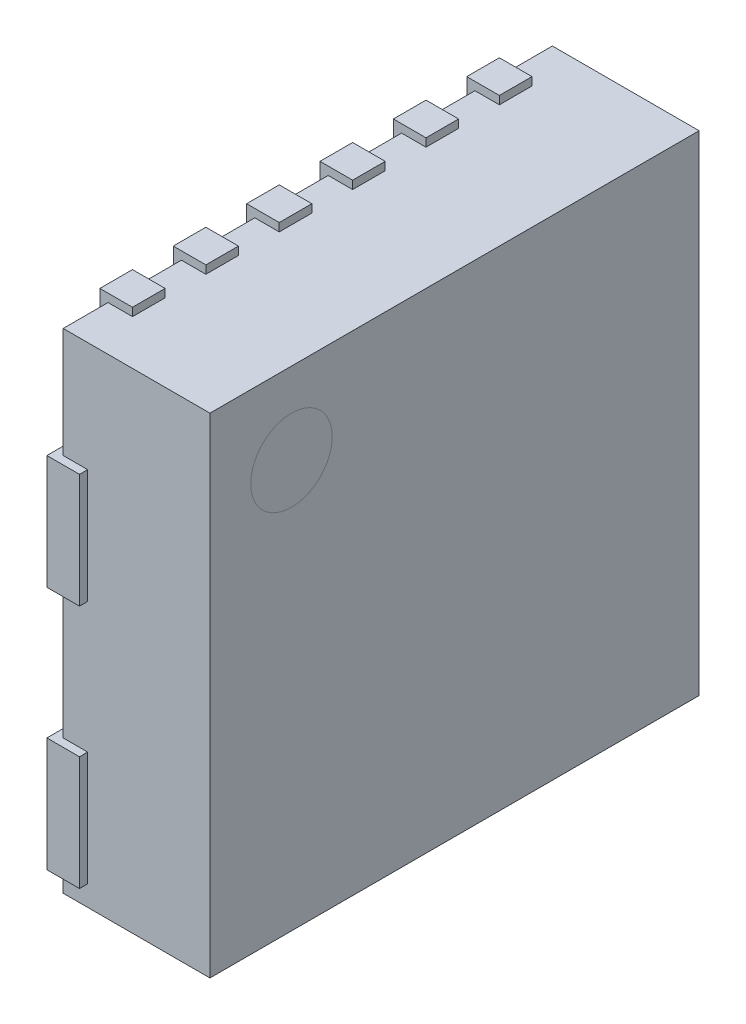
from build123d import *

# Parameters (mm, degrees)
SKETCH_1_W              = 3
SKETCH_1_H              = 3
EXTRUDE_1_DEPTH         = 0.9
SKETCH_2_R              = 0.25
CUT_EXTRUDE_1_DEPTH     = 0.1
SKETCH_3_R              = 0.25
EXTRUDE_2_DEPTH         = 0.05
EXTRUDE_3_DEPTH         = 0.05
EXTRUDE_3_DEPTH_BACK    = 0.15
SKETCH_4_W              = 0.2
SKETCH_4_H              = 0.4
EXTRUDE_3_2_DEPTH       = 0.05
EXTRUDE_3_2_DEPTH_BACK  = 0.15
EXTRUDE_3_3_DEPTH       = 0.05
EXTRUDE_3_3_DEPTH_BACK  = 0.15
EXTRUDE_3_4_DEPTH       = 0.05
EXTRUDE_3_4_DEPTH_BACK  = 0.15
EXTRUDE_3_5_DEPTH       = 0.05
EXTRUDE_3_5_DEPTH_BACK  = 0.15
EXTRUDE_3_6_DEPTH       = 0.05
EXTRUDE_3_6_DEPTH_BACK  = 0.15
EXTRUDE_3_7_DEPTH       = 0.05
EXTRUDE_3_7_DEPTH_BACK  = 0.15
EXTRUDE_3_8_DEPTH       = 0.05
EXTRUDE_3_8_DEPTH_BACK  = 0.15
EXTRUDE_3_9_DEPTH       = 0.05
EXTRUDE_3_9_DEPTH_BACK  = 0.15
EXTRUDE_3_10_DEPTH      = 0.05
EXTRUDE_3_10_DEPTH_BACK = 0.15
SKETCH_4_W_2            = 1
SKETCH_4_H_2            = 0.26
EXTRUDE_3_11_DEPTH      = 0.05
EXTRUDE_3_11_DEPTH_BACK = 0.15
EXTRUDE_3_12_DEPTH      = 0.05
EXTRUDE_3_12_DEPTH_BACK = 0.15
SKETCH_4_H_3            = 0.7


with BuildPart() as part:
    # Эскиз1 → Бобышка-Вытянуть1 (new body)
    with BuildSketch(Plane(origin=(0.05, 0, 0), x_dir=(0, 0, -1), z_dir=(1, 0, 0))):
        Rectangle(SKETCH_1_W, SKETCH_1_H)
    extrude(amount=EXTRUDE_1_DEPTH)

    # Эскиз2 → Вырез-Вытянуть1 (cut)
    with BuildSketch(Plane(origin=(0.95, 0, 0), x_dir=(0, 0, -1), z_dir=(1, 0, 0))):
        with Locations((-1, 1)):
            Circle(SKETCH_2_R)
    extrude(amount=-CUT_EXTRUDE_1_DEPTH, mode=Mode.SUBTRACT)


with BuildPart() as body_2:
    # Эскиз3 → Бобышка-Вытянуть2 (new body)
    with BuildSketch(Plane(origin=(0.9, 0, 0), x_dir=(0, 0, -1), z_dir=(1, 0, 0))):
        with Locations((-1, 1)):
            Circle(SKETCH_3_R)
    extrude(amount=EXTRUDE_2_DEPTH)


with BuildPart() as body_3:
    # Эскиз4 → Бобышка-Вытянуть3 (new, two sides: drawn at the far end of the back side and taken through both)
    with BuildSketch(Plane.ZY.offset(-0.05).offset(-EXTRUDE_3_DEPTH_BACK)):
        with Locations((-1.125, 1.35)):
            Rectangle(SKETCH_4_W, SKETCH_4_H)
    extrude(amount=EXTRUDE_3_DEPTH + EXTRUDE_3_DEPTH_BACK)


with BuildPart() as body_4:
    # Эскиз4 → Extrude 3 2 (new, two sides: drawn at the far end of the back side and taken through both)
    with BuildSketch(Plane.ZY.offset(-0.05).offset(-EXTRUDE_3_2_DEPTH_BACK)):
        with Locations((-0.675, 1.35)):
            Rectangle(SKETCH_4_W, SKETCH_4_H)
    extrude(amount=EXTRUDE_3_2_DEPTH + EXTRUDE_3_2_DEPTH_BACK)


with BuildPart() as body_5:
    # Эскиз4 → Extrude 3 3 (new, two sides: drawn at the far end of the back side and taken through both)
    with BuildSketch(Plane.ZY.offset(-0.05).offset(-EXTRUDE_3_3_DEPTH_BACK)):
        with Locations((-0.225, 1.35)):
            Rectangle(SKETCH_4_W, SKETCH_4_H)
    extrude(amount=EXTRUDE_3_3_DEPTH + EXTRUDE_3_3_DEPTH_BACK)


with BuildPart() as body_6:
    # Эскиз4 → Extrude 3 4 (new, two sides: drawn at the far end of the back side and taken through both)
    with BuildSketch(Plane.ZY.offset(-0.05).offset(-EXTRUDE_3_4_DEPTH_BACK)):
        with Locations((0.225, 1.35)):
            Rectangle(SKETCH_4_W, SKETCH_4_H)
    extrude(amount=EXTRUDE_3_4_DEPTH + EXTRUDE_3_4_DEPTH_BACK)


with BuildPart() as body_7:
    # Эскиз4 → Extrude 3 5 (new, two sides: drawn at the far end of the back side and taken through both)
    with BuildSketch(Plane.ZY.offset(-0.05).offset(-EXTRUDE_3_5_DEPTH_BACK)):
        with Locations((0.675, 1.35)):
            Rectangle(SKETCH_4_W, SKETCH_4_H)
    extrude(amount=EXTRUDE_3_5_DEPTH + EXTRUDE_3_5_DEPTH_BACK)


with BuildPart() as body_8:
    # Эскиз4 → Extrude 3 6 (new, two sides: drawn at the far end of the back side and taken through both)
    with BuildSketch(Plane.ZY.offset(-0.05).offset(-EXTRUDE_3_6_DEPTH_BACK)):
        with Locations((1.125, 1.35)):
            Rectangle(SKETCH_4_W, SKETCH_4_H)
    extrude(amount=EXTRUDE_3_6_DEPTH + EXTRUDE_3_6_DEPTH_BACK)


with BuildPart() as body_9:
    # Эскиз4 → Extrude 3 7 (new, two sides: drawn at the far end of the back side and taken through both)
    with BuildSketch(Plane.ZY.offset(-0.05).offset(-EXTRUDE_3_7_DEPTH_BACK)):
        Polygon((1.55, 0.825), (-0.25, 0.825), (-0.25, 0.425), (0.2, 0.425), (0.5, 0.125), (1.55, 0.125), align=None)
    extrude(amount=EXTRUDE_3_7_DEPTH + EXTRUDE_3_7_DEPTH_BACK)


with BuildPart() as body_10:
    # Эскиз4 → Extrude 3 8 (new, two sides: drawn at the far end of the back side and taken through both)
    with BuildSketch(Plane.ZY.offset(-0.05).offset(-EXTRUDE_3_8_DEPTH_BACK)):
        Polygon((-0.2, 0.15), (0.2, 0.15), (0.55, -0.2), (0.55, -0.35), (0.2, -0.7), (-0.2, -0.7), (-0.55, -0.35), (-0.55, -0.2), align=None)
    extrude(amount=EXTRUDE_3_8_DEPTH + EXTRUDE_3_8_DEPTH_BACK)


with BuildPart() as body_11:
    # Эскиз4 → Extrude 3 9 (new, two sides: drawn at the far end of the back side and taken through both)
    with BuildSketch(Plane.ZY.offset(-0.05).offset(-EXTRUDE_3_9_DEPTH_BACK)):
        Polygon((1.55, -0.675), (1.55, -1.375), (-0.25, -1.375), (-0.25, -0.975), (0.2, -0.975), (0.5, -0.675), align=None)
    extrude(amount=EXTRUDE_3_9_DEPTH + EXTRUDE_3_9_DEPTH_BACK)


with BuildPart() as body_12:
    # Эскиз4 → Extrude 3 10 (new, two sides: drawn at the far end of the back side and taken through both)
    with BuildSketch(Plane.ZY.offset(-0.05).offset(-EXTRUDE_3_10_DEPTH_BACK)):
        with Locations((-1.05, 0.225)):
            Rectangle(SKETCH_4_W_2, SKETCH_4_H_2)
    extrude(amount=EXTRUDE_3_10_DEPTH + EXTRUDE_3_10_DEPTH_BACK)


with BuildPart() as body_13:
    # Эскиз4 → Extrude 3 11 (new, two sides: drawn at the far end of the back side and taken through both)
    with BuildSketch(Plane.ZY.offset(-0.05).offset(-EXTRUDE_3_11_DEPTH_BACK)):
        with Locations((-1.05, 0.675)):
            Rectangle(SKETCH_4_W_2, SKETCH_4_H_2)
    extrude(amount=EXTRUDE_3_11_DEPTH + EXTRUDE_3_11_DEPTH_BACK)


with BuildPart() as body_14:
    # Эскиз4 → Extrude 3 12 (new, two sides: drawn at the far end of the back side and taken through both)
    with BuildSketch(Plane.ZY.offset(-0.05).offset(-EXTRUDE_3_12_DEPTH_BACK)):
        with Locations((-1.05, -1.025)):
            Rectangle(SKETCH_4_W_2, SKETCH_4_H_3)
    extrude(amount=EXTRUDE_3_12_DEPTH + EXTRUDE_3_12_DEPTH_BACK)


solid = Compound([part.part, body_2.part, body_3.part, body_4.part, body_5.part, body_6.part, body_7.part, body_8.part, body_9.part, body_10.part, body_11.part, body_12.part, body_13.part, body_14.part])
